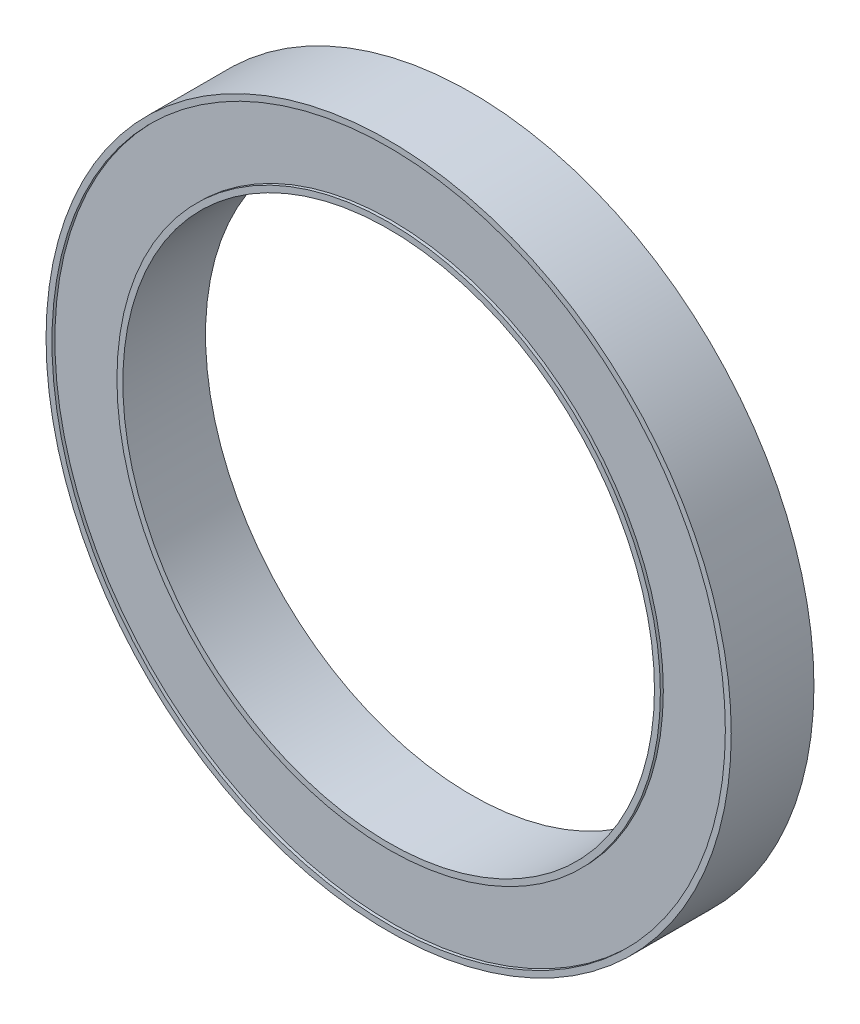
from build123d import *

# Parameters (mm, degrees)
SKETCH1_R           = 29
SKETCH1_R_2         = 22.5
BOSS_EXTRUDE1_DEPTH = 3.5
SKETCH2_R           = 28.5
SKETCH2_R_2         = 23
CUT_EXTRUDE1_DEPTH  = 0.25


with BuildPart() as part:
    # Sketch1 → Boss-Extrude1 (new, symmetric)
    with BuildSketch(Plane.XY):
        Circle(SKETCH1_R)
        Circle(SKETCH1_R_2, mode=Mode.SUBTRACT)
    extrude(amount=BOSS_EXTRUDE1_DEPTH, both=True)

    # Sketch2 → Cut-Extrude1 (cut)
    with BuildSketch(Plane.XY.offset(3.5)):
        Circle(SKETCH2_R)
        Circle(SKETCH2_R_2, mode=Mode.SUBTRACT)
    cut_extrude1 = extrude(amount=-CUT_EXTRUDE1_DEPTH, mode=Mode.SUBTRACT)

    # Mirror1: Cut-Extrude1 across plane
    add(cut_extrude1.mirror(Plane.XY), mode=Mode.SUBTRACT)


solid = part.part
